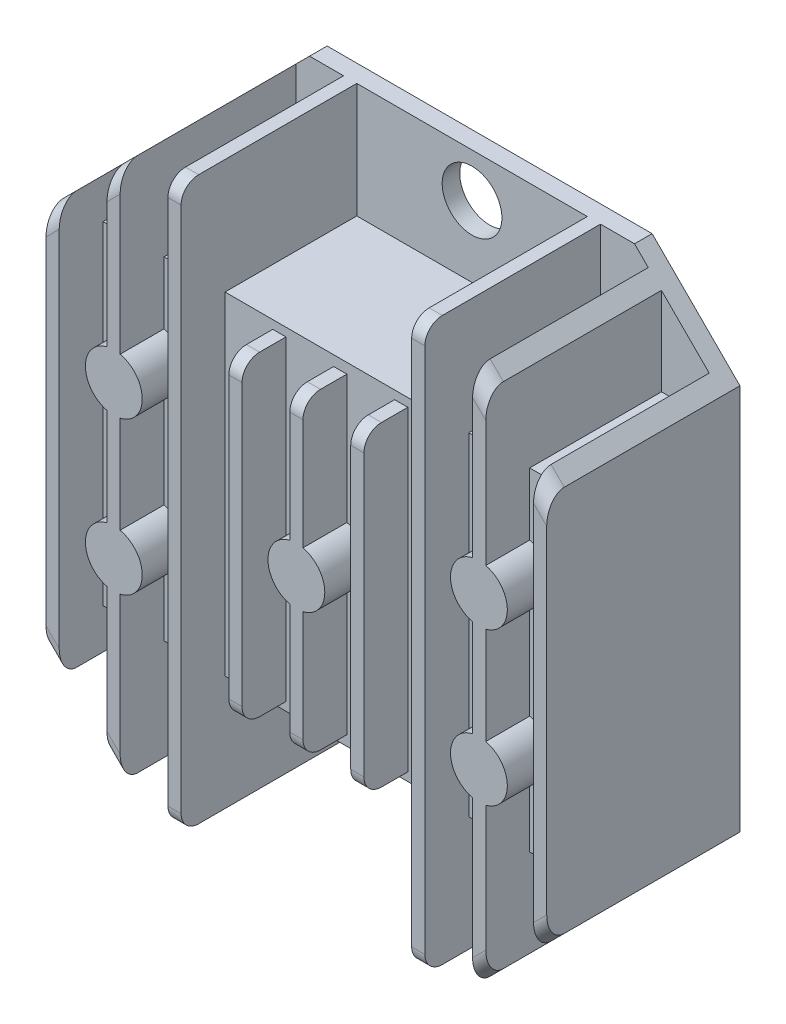
from build123d import *

# Parameters (mm, degrees)
SKIZZE1_R                                   = 3.4
AUFSATZ_LINEAR_AUSTRAGEN1_DEPTH             = 2
SKIZZE2_W                                   = 57
SKIZZE2_H                                   = 18.932808473
AUFSATZ_LINEAR_AUSTRAGEN2_DEPTH             = 15
SCHNITT_LINEAR_AUSTRAGEN1_DEPTH             = 47.100433837
SCHNITT_LINEAR_AUSTRAGEN1_DEPTH_BACK        = 47.100433837
SKIZZE3_W                                   = 34.623433363
SKIZZE3_H                                   = 45.110839659
AUFSATZ_LINEAR_AUSTRAGEN3_REACH             = 48.1
SKIZZE4_W                                   = 1.5
SKIZZE4_H                                   = 32
SKIZZE4_H_2                                 = 17.972917063
SKIZZE4_W_2                                 = 0.75
SKIZZE4_H_3                                 = 17.775625357
AUFSATZ_LINEAR_AUSTRAGEN3_DIRECTION_2_DEPTH = 5
VERRUNDUNG1_R                               = 2
SKIZZE5_R                                   = 3.234578413
AUFSATZ_LINEAR_AUSTRAGEN4_DEPTH             = 5
AUFSATZ_LINEAR_AUSTRAGEN7_DEPTH             = 5
SKIZZE7_R                                   = 1.5
AUFSATZ_LINEAR_AUSTRAGEN9_DEPTH             = 11
AUFSATZ_LINEAR_AUSTRAGEN9_2_DEPTH           = 11
AUFSATZ_LINEAR_AUSTRAGEN9_3_DEPTH           = 11


with BuildPart() as part:
    # Skizze1 → Aufsatz-Linear austragen1 (new body)
    with BuildSketch(Plane(origin=(0, 0, 0), x_dir=(0, 1, 0), z_dir=(0, 0, 1))):
        Polygon((22, 28.5), (32, 18.5), (32, -18.5), (22, -28.5), (0, -28.5), (0, 28.5), align=None)
        with Locations(Location((27, 0, 0), (0, 0, 270))):
            Circle(SKIZZE1_R, mode=Mode.SUBTRACT)
    extrude(amount=AUFSATZ_LINEAR_AUSTRAGEN1_DEPTH)

    # Skizze2 → Aufsatz-Linear austragen2 (add)
    with BuildSketch(Plane.XY.offset(2)):
        with Locations((0, 9.466404237)):
            Rectangle(SKIZZE2_W, SKIZZE2_H)
    extrude(amount=AUFSATZ_LINEAR_AUSTRAGEN2_DEPTH)

    # Skizze3 → Schnitt-Linear austragen1 (cut, two sides: drawn at the far end of the back side and taken through both)
    with BuildSketch(Plane.XY.offset(17).offset(-SCHNITT_LINEAR_AUSTRAGEN1_DEPTH_BACK)):
        with Locations((-17.311716682, 22.555419829)):
            Rectangle(SKIZZE3_W, SKIZZE3_H)
    extrude(amount=SCHNITT_LINEAR_AUSTRAGEN1_DEPTH + SCHNITT_LINEAR_AUSTRAGEN1_DEPTH_BACK, mode=Mode.SUBTRACT)

    # Aufsatz-Linear austragen3: up to this face of the body (flat: up to its plane)
    aufsatz_linear_austragen3_end = Plane(part.part.faces().sort_by_distance((13.22034684, 24.848962234, 2))[0])
    # Skizze4 → Aufsatz-Linear austragen3 (add, up to the picked face)
    with BuildSketch(Plane.XY.offset(17), mode=Mode.PRIVATE) as aufsatz_linear_austragen3_sk1:
        with Locations((13.875, 16)):
            Rectangle(SKIZZE4_W, SKIZZE4_H)
    aufsatz_linear_austragen3_tool1 = split(extrude(aufsatz_linear_austragen3_sk1.sketch, amount=-AUFSATZ_LINEAR_AUSTRAGEN3_REACH, mode=Mode.PRIVATE), bisect_by=aufsatz_linear_austragen3_end, keep=Keep.BOTH, mode=Mode.PRIVATE)
    # Skizze4 → Aufsatz-Linear austragen3 (add, up to the picked face)
    with BuildSketch(Plane.XY.offset(17), mode=Mode.PRIVATE) as aufsatz_linear_austragen3_sk2:
        Polygon((27, 23.5), (28.5, 22), (28.5, 0), (27, 0), align=None)
    aufsatz_linear_austragen3_tool2 = split(extrude(aufsatz_linear_austragen3_sk2.sketch, amount=-AUFSATZ_LINEAR_AUSTRAGEN3_REACH, mode=Mode.PRIVATE), bisect_by=aufsatz_linear_austragen3_end, keep=Keep.BOTH, mode=Mode.PRIVATE)
    # Skizze4 → Aufsatz-Linear austragen3 (add, up to the picked face)
    with BuildSketch(Plane.XY.offset(17), mode=Mode.PRIVATE) as aufsatz_linear_austragen3_sk3:
        Polygon((20.0625, 0), (21.5625, 0), (21.5625, 28.9375), (20.0625, 30.4375), align=None)
    aufsatz_linear_austragen3_tool3 = split(extrude(aufsatz_linear_austragen3_sk3.sketch, amount=-AUFSATZ_LINEAR_AUSTRAGEN3_REACH, mode=Mode.PRIVATE), bisect_by=aufsatz_linear_austragen3_end, keep=Keep.BOTH, mode=Mode.PRIVATE)
    # Skizze4 → Aufsatz-Linear austragen3 (add, up to the picked face)
    with BuildSketch(Plane.XY.offset(17), mode=Mode.PRIVATE) as aufsatz_linear_austragen3_sk4:
        with Locations((6.9375, 8.986458532)):
            Rectangle(SKIZZE4_W, SKIZZE4_H_2)
    aufsatz_linear_austragen3_tool4 = split(extrude(aufsatz_linear_austragen3_sk4.sketch, amount=-AUFSATZ_LINEAR_AUSTRAGEN3_REACH, mode=Mode.PRIVATE), bisect_by=aufsatz_linear_austragen3_end, keep=Keep.BOTH, mode=Mode.PRIVATE)
    # Skizze4 → Aufsatz-Linear austragen3 (add, up to the picked face)
    with BuildSketch(Plane.XY.offset(17), mode=Mode.PRIVATE) as aufsatz_linear_austragen3_sk5:
        with Locations((0.375, 8.887812679)):
            Rectangle(SKIZZE4_W_2, SKIZZE4_H_3)
    aufsatz_linear_austragen3_tool5 = split(extrude(aufsatz_linear_austragen3_sk5.sketch, amount=-AUFSATZ_LINEAR_AUSTRAGEN3_REACH, mode=Mode.PRIVATE), bisect_by=aufsatz_linear_austragen3_end, keep=Keep.BOTH, mode=Mode.PRIVATE)
    add(aufsatz_linear_austragen3_tool1.solids().sort_by(Axis((13.875, 16, 17), (0, 0, -1)))[0])
    add(aufsatz_linear_austragen3_tool2.solids().sort_by(Axis((27.741758, 11.379121, 17), (0, 0, -1)))[0])
    add(aufsatz_linear_austragen3_tool3.solids().sort_by(Axis((20.806184, 14.846908, 17), (0, 0, -1)))[0])
    add(aufsatz_linear_austragen3_tool4.solids().sort_by(Axis((6.9375, 8.986459, 17), (0, 0, -1)))[0])
    add(aufsatz_linear_austragen3_tool5.solids().sort_by(Axis((0.375, 8.887813, 17), (0, 0, -1)))[0])

    # Skizze4 → Aufsatz-Linear austragen3 direction 2 (add)
    with BuildSketch(Plane.XY.offset(17)):
        with Locations((13.875, 16)):
            Rectangle(SKIZZE4_W, SKIZZE4_H)
        Polygon((27, 23.5), (28.5, 22), (28.5, 0), (27, 0), align=None)
        Polygon((20.0625, 0), (21.5625, 0), (21.5625, 28.9375), (20.0625, 30.4375), align=None)
        with Locations((6.9375, 8.986458532)):
            Rectangle(SKIZZE4_W, SKIZZE4_H_2)
        with Locations((0.375, 8.887812679)):
            Rectangle(SKIZZE4_W_2, SKIZZE4_H_3)
    extrude(amount=AUFSATZ_LINEAR_AUSTRAGEN3_DIRECTION_2_DEPTH)

    # Verrundung1
    verrundung1_edges = [part.edges().sort_by_distance(p)[0] for p in [
        (0.375, 17.775625357, 22),
        (27.75, 22.75, 22),
        (20.8125, 29.6875, 22),
        (13.875, 32, 22),
        (6.9375, 17.972917063, 22),
    ]]
    fillet(verrundung1_edges, radius=VERRUNDUNG1_R)

    # Skizze5 → Aufsatz-Linear austragen4 (add)
    with BuildSketch(Plane.XY.offset(22)):
        with Locations((20.782589152, 8.678120593)):
            Circle(SKIZZE5_R)
    extrude(amount=-AUFSATZ_LINEAR_AUSTRAGEN4_DEPTH)

    # Skizze6 → Aufsatz-Linear austragen7 (add)
    with BuildSketch(Plane.XY.offset(17)):
        with BuildLine():
            Line((0.75, 0), (3.234578413, 0))
            ThreePointArc((3.234578413, 0), (2.538545974, 2.004565252), (0.75, 3.146426149))
            Line((0.75, 3.146426149), (0.75, 0))
        make_face()
        with BuildLine():
            Line((0, 0), (0.75, 0))
            Line((0.75, 0), (0.75, 3.146426149))
            ThreePointArc((0.75, 3.146426149), (0.377581389, 3.212464755), (0, 3.234578413))
            Line((0, 3.234578413), (0, 0))
        make_face()
    extrude(amount=AUFSATZ_LINEAR_AUSTRAGEN7_DEPTH)

    # Spiegeln1: part across face


with BuildPart() as part_1:
    add(part.part)
    add(part.part.mirror(Plane(origin=(14.039898882, 0, 9.457090178), x_dir=(0, 0, 1), z_dir=(0, -1, 0))))

    # Spiegeln2: part across plane


with BuildPart() as part_2:
    add(part_1.part)
    add(part_1.part.mirror(Plane(origin=(0, 0, 0), x_dir=(0, 0, 1), z_dir=(1, 0, 0))))


with BuildPart() as body_2:
    # Skizze7 → Aufsatz-Linear austragen9 (new body)
    with BuildSketch(Plane(origin=(-28.5, 0, 0), x_dir=(0, -1, 0), z_dir=(-1, 0, 0))):
        with Locations(Location((-3, 2.885859275, 0), (0, 0, 90))):
            Circle(SKIZZE7_R)
    extrude(amount=AUFSATZ_LINEAR_AUSTRAGEN9_DEPTH)


with BuildPart() as body_3:
    # Skizze7 → Aufsatz-Linear austragen9 2 (new body)
    with BuildSketch(Plane(origin=(-28.5, 0, 0), x_dir=(0, -1, 0), z_dir=(-1, 0, 0))):
        with Locations(Location((0, 2.885859275, 0), (0, 0, 90))):
            Circle(SKIZZE7_R)
    extrude(amount=AUFSATZ_LINEAR_AUSTRAGEN9_2_DEPTH)


with BuildPart() as body_4:
    # Skizze7 → Aufsatz-Linear austragen9 3 (new body)
    with BuildSketch(Plane(origin=(-28.5, 0, 0), x_dir=(0, -1, 0), z_dir=(-1, 0, 0))):
        with Locations(Location((3, 2.885859275, 0), (0, 0, 90))):
            Circle(SKIZZE7_R)
    extrude(amount=AUFSATZ_LINEAR_AUSTRAGEN9_3_DEPTH)


solid = Compound([part_2.part, body_2.part, body_3.part, body_4.part])
